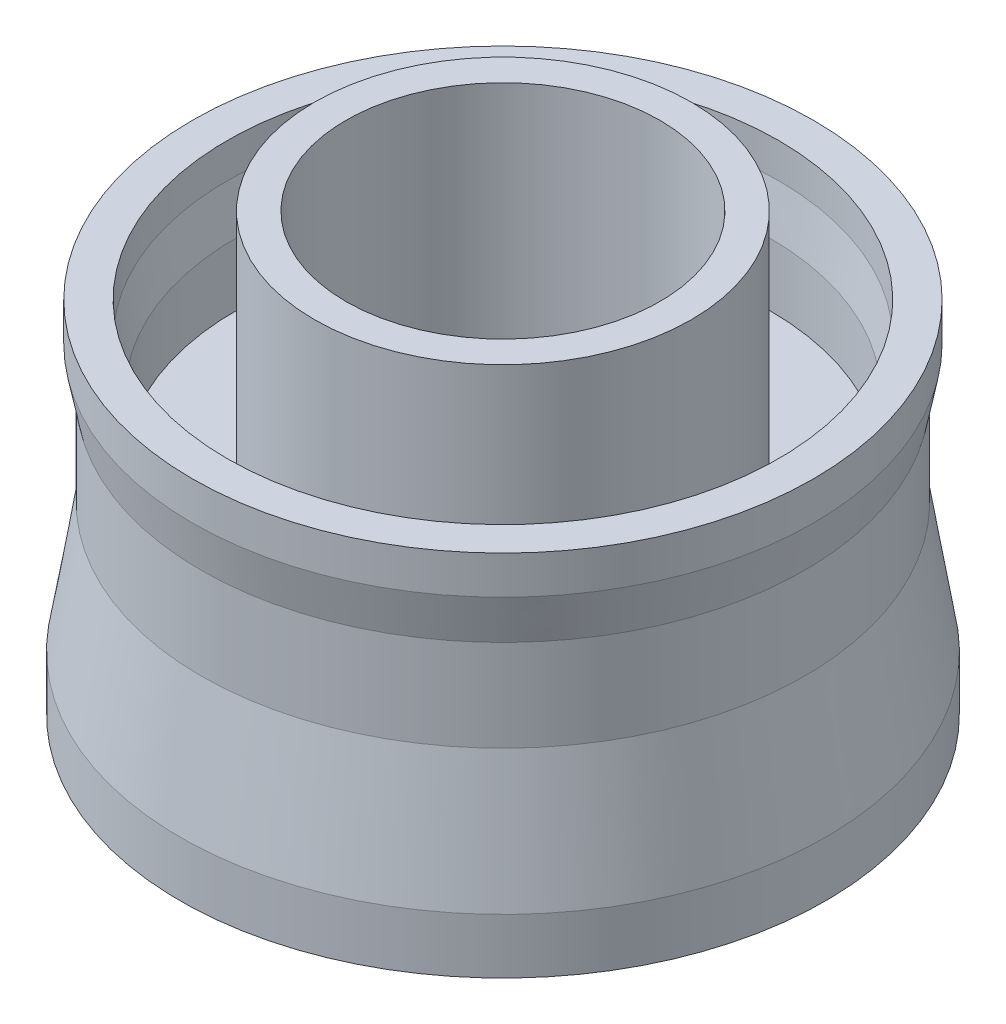
from build123d import *

# Parameters (mm, degrees)
SKETCH2_W = 2.05
SKETCH2_H = 1


with BuildPart() as part:
    # Sketch1 → Revolve1 (revolve)
    with BuildSketch(Plane(origin=(0, 0, 0), x_dir=(0, 0, -1), z_dir=(1, 0, 0))):
        Polygon((4.65, 1), (4.65, 4.3), (4.5, 4.3), (4.5, 12.5), (5.4, 12.5), (5.4, 6.2), (5.6, 6.2), (5.6, 0), (4.8, 0), align=None)
    revolve(axis=Axis((0, 0, 0), (0, 1, 0)))

    # Sketch2 → Revolve2 (revolve)
    with BuildSketch(Plane(origin=(0, 0, 0), x_dir=(0, 0, -1), z_dir=(1, 0, 0))):
        with Locations((6.625, 5.7)):
            Rectangle(SKETCH2_W, SKETCH2_H)
    revolve(axis=Axis((0, 0, 0), (0, 1, 0)))

    # Sketch3 → Revolve-Thin1 (revolve)
    with BuildSketch(Plane(origin=(0, 0, 0), x_dir=(0, 0, -1), z_dir=(1, 0, 0))):
        Polygon((7.9, 10.3), (7.9, 9.3), (7.65, 8), (7.65, 5.2), (8.25, 1.5), (8.25, 0), (9.25, 0), (9.25, 1.580554938), (8.65, 5.280554938), (8.65, 7.904719082), (8.9, 9.204719082), (8.9, 10.3), align=None)
    revolve(axis=Axis((0, 0, 0), (0, 1, 0)))


solid = part.part
